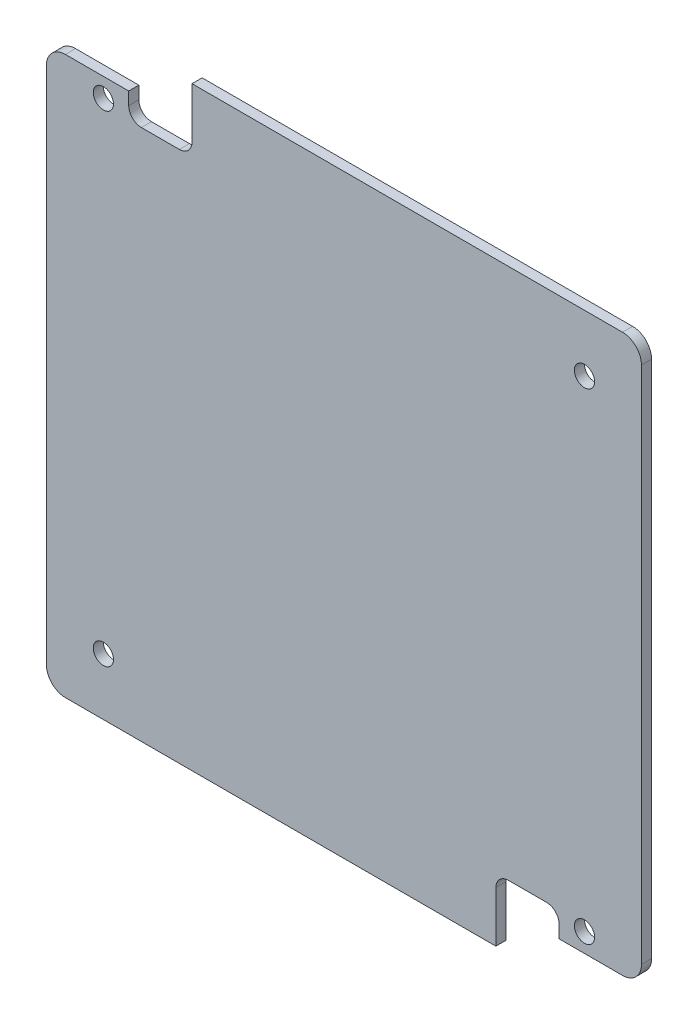
from build123d import *

# Parameters (mm, degrees)
BOSS_EXTRUDE1_DEPTH        = 1.6
F_3_2_3_2_DIAMETER_HOLE3_D = 3.2
FILLET1_R                  = 2


with BuildPart() as part:
    # Sketch1 → Boss-Extrude1 (new body)
    with BuildSketch(Plane.XY):
        with BuildLine():
            Line((-84.56534388, -2.04814307), (-16.56534388, -2.04814307))
            Line((-16.56534388, -2.04814307), (-16.56534388, 7.95185693))
            Line((-16.56534388, 7.95185693), (-6.56534388, 7.95185693))
            Line((-6.56534388, 7.95185693), (-6.56534388, 3.95185693))
            Line((-6.56534388, 3.95185693), (3.425708931, 3.95185693))
            Line((3.425708931, 3.95185693), (3.43465612, 3.95185693))
            ThreePointArc((3.43465612, 3.95185693), (5.555976464, 4.830536587), (6.43465612, 6.95185693))
            Line((6.43465612, 6.95185693), (6.43465612, 88.95185693))
            ThreePointArc((6.43465612, 88.95185693), (5.555976464, 91.073177274), (3.43465612, 91.95185693))
            Line((3.43465612, 91.95185693), (-64.56534388, 91.95185693))
            Line((-64.56534388, 91.95185693), (-64.56534388, 81.95185693))
            Line((-64.56534388, 81.95185693), (-74.56534388, 81.95185693))
            Line((-74.56534388, 81.95185693), (-74.56534388, 85.95185693))
            Line((-74.56534388, 85.95185693), (-84.56534388, 85.95185693))
            ThreePointArc((-84.56534388, 85.95185693), (-86.686664224, 85.073177274), (-87.56534388, 82.95185693))
            Line((-87.56534388, 82.95185693), (-87.56534388, 0.95185693))
            ThreePointArc((-87.56534388, 0.95185693), (-86.686664224, -1.169463413), (-84.56534388, -2.04814307))
        make_face()
    extrude(amount=BOSS_EXTRUDE1_DEPTH)

    # Ø3.2 (3.2) Diameter Hole3 (through all)
    with Locations(Plane(origin=(0, 0, 0), x_dir=(-1, 0, 0), z_dir=(0, 0, -1))):
        with Locations((78.56534388, 6.95185693), (78.56534388, 82.95185693), (2.56534388, 82.95185693), (2.56534388, 6.95185693)):
            Hole(F_3_2_3_2_DIAMETER_HOLE3_D / 2)

    # Fillet1
    fillet1_edges = [part.edges().sort_by_distance(p)[0] for p in [
        (-16.56534388, 7.95185693, 0.8),
        (-74.56534388, 81.95185693, 0.8),
        (-64.56534388, 81.95185693, 0.8),
        (-6.56534388, 7.95185693, 0.8),
    ]]
    fillet(fillet1_edges, radius=FILLET1_R)


solid = part.part
